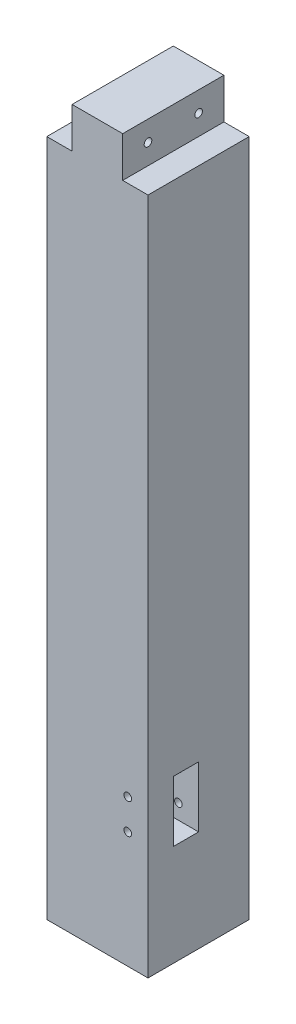
from build123d import *

# Parameters (mm, degrees)
SKETCH1_W           = 63.5
SKETCH1_H           = 50.8
BOSS_EXTRUDE1_DEPTH = 127
SKETCH2_W           = 31.75
SKETCH2_H           = 76.2
CUT_EXTRUDE1_DEPTH  = 50.8
CUT_EXTRUDE3_DEPTH  = 82.55
SKETCH4_W           = 31.75
SKETCH4_H           = 76.2
CUT_EXTRUDE4_DEPTH  = 63.5
CUT_EXTRUDE5_DEPTH  = 76.2
SKETCH6_R           = 4.7625
CUT_EXTRUDE6_DEPTH  = 503.011578552


with BuildPart() as part:
    # Sketch1 → Boss-Extrude1 (new body)
    with BuildSketch(Plane.XY):
        Polygon((63.5, -425.45), (63.5, 425.45), (31.75, 425.45), (31.75, 374.65), (-31.75, 374.65), (-31.75, 425.45), (-63.5, 425.45), (-63.5, -425.45), align=None)
        with Locations((0, 400.05)):
            Rectangle(SKETCH1_W, SKETCH1_H)
        with Locations((0, 450.85)):
            Rectangle(SKETCH1_W, SKETCH1_H)
    extrude(amount=BOSS_EXTRUDE1_DEPTH)

    # Sketch2 → Cut-Extrude1 (cut)
    with BuildSketch(Plane(origin=(63.5, 0, 0), x_dir=(0, 0, -1), z_dir=(1, 0, 0))):
        with Locations((-79.375, -260.35)):
            Rectangle(SKETCH2_W, SKETCH2_H)
    extrude(amount=-CUT_EXTRUDE1_DEPTH, mode=Mode.SUBTRACT)

    # Sketch3 → Cut-Extrude3 (cut)
    with BuildSketch(Plane.XY.offset(127)):
        with BuildLine():
            ThreePointArc((42.8625, -279.4), (41.467596045, -276.032403955), (38.1, -274.6375))
            Line((38.1, -274.6375), (38.1, -284.1625))
            ThreePointArc((38.1, -284.1625), (41.467596045, -282.767596045), (42.8625, -279.4))
        make_face()
        with BuildLine():
            Line((38.1, -284.1625), (38.1, -274.6375))
            ThreePointArc((38.1, -274.6375), (33.3375, -279.4), (38.1, -284.1625))
        make_face()
        with BuildLine():
            ThreePointArc((42.8625, -241.3), (41.467596045, -237.932403955), (38.1, -236.5375))
            Line((38.1, -236.5375), (38.1, -246.0625))
            ThreePointArc((38.1, -246.0625), (41.467596045, -244.667596045), (42.8625, -241.3))
        make_face()
        with BuildLine():
            Line((38.1, -246.0625), (38.1, -236.5375))
            ThreePointArc((38.1, -236.5375), (33.3375, -241.3), (38.1, -246.0625))
        make_face()
    extrude(amount=-CUT_EXTRUDE3_DEPTH, mode=Mode.SUBTRACT)

    # Sketch4 → Cut-Extrude4 (cut)
    with BuildSketch(Plane(origin=(0, 0, 0), x_dir=(-1, 0, 0), z_dir=(0, 0, -1))):
        with Locations((15.875, -260.35)):
            Rectangle(SKETCH4_W, SKETCH4_H)
    extrude(amount=-CUT_EXTRUDE4_DEPTH, mode=Mode.SUBTRACT)

    # Sketch5 → Cut-Extrude5 (cut)
    with BuildSketch(Plane.ZY.offset(63.5)):
        with BuildLine():
            ThreePointArc((31.75, -236.5375), (26.9875, -241.3), (31.75, -246.0625))
            Line((31.75, -246.0625), (31.75, -236.5375))
        make_face()
        with BuildLine():
            Line((31.75, -236.5375), (31.75, -246.0625))
            ThreePointArc((31.75, -246.0625), (35.117596045, -244.667596045), (36.5125, -241.3))
            ThreePointArc((36.5125, -241.3), (35.117596045, -237.932403955), (31.75, -236.5375))
        make_face()
        with BuildLine():
            ThreePointArc((31.75, -274.6375), (26.9875, -279.4), (31.75, -284.1625))
            Line((31.75, -284.1625), (31.75, -274.6375))
        make_face()
        with BuildLine():
            Line((31.75, -274.6375), (31.75, -284.1625))
            ThreePointArc((31.75, -284.1625), (35.117596045, -282.767596045), (36.5125, -279.4))
            ThreePointArc((36.5125, -279.4), (35.117596045, -276.032403955), (31.75, -274.6375))
        make_face()
    extrude(amount=-CUT_EXTRUDE5_DEPTH, mode=Mode.SUBTRACT)

    # Sketch6 → Cut-Extrude6 (cut, through all)
    with BuildSketch(Plane(origin=(31.75, 0, 0), x_dir=(0, 0, -1), z_dir=(1, 0, 0))):
        with Locations(Location((-95.25, 450.85, 0), (0, 0, 90))):
            Circle(SKETCH6_R)
        with Locations(Location((-31.75, 450.85, 0), (0, 0, 90))):
            Circle(SKETCH6_R)
    extrude(amount=-CUT_EXTRUDE6_DEPTH, mode=Mode.SUBTRACT)


solid = part.part
